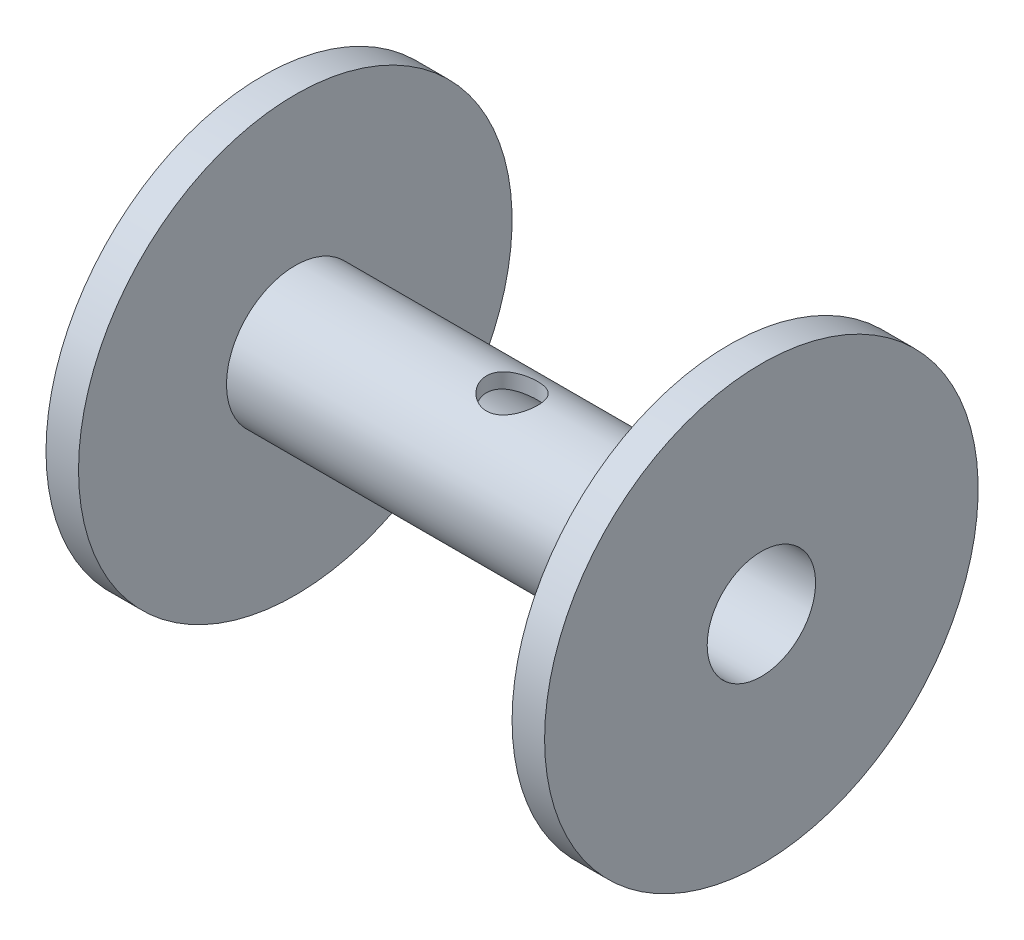
from build123d import *

# Parameters (mm, degrees)
SKETCH2_R          = 1.5
CUT_EXTRUDE1_DEPTH = 24.14921219


with BuildPart() as part:
    # Sketch1 → Revolve1 (revolve)
    with BuildSketch(Plane.XY):
        Polygon((14.605, 3.175), (14.605, 12.7), (12.7, 12.7), (12.7, 4.03225), (-12.7, 4.03225), (-12.7, 12.7), (-14.605, 12.7), (-14.605, 3.175), align=None)
    revolve(axis=Axis((-15.275524476, 0, 0), (1, 0, 0)))

    # Sketch2 → Cut-Extrude1 (cut, through all)
    with BuildSketch(Plane(origin=(0, 0, 0), x_dir=(1, 0, 0), z_dir=(0, 1, 0))):
        Circle(SKETCH2_R)
    extrude(amount=CUT_EXTRUDE1_DEPTH, mode=Mode.SUBTRACT)


solid = part.part
